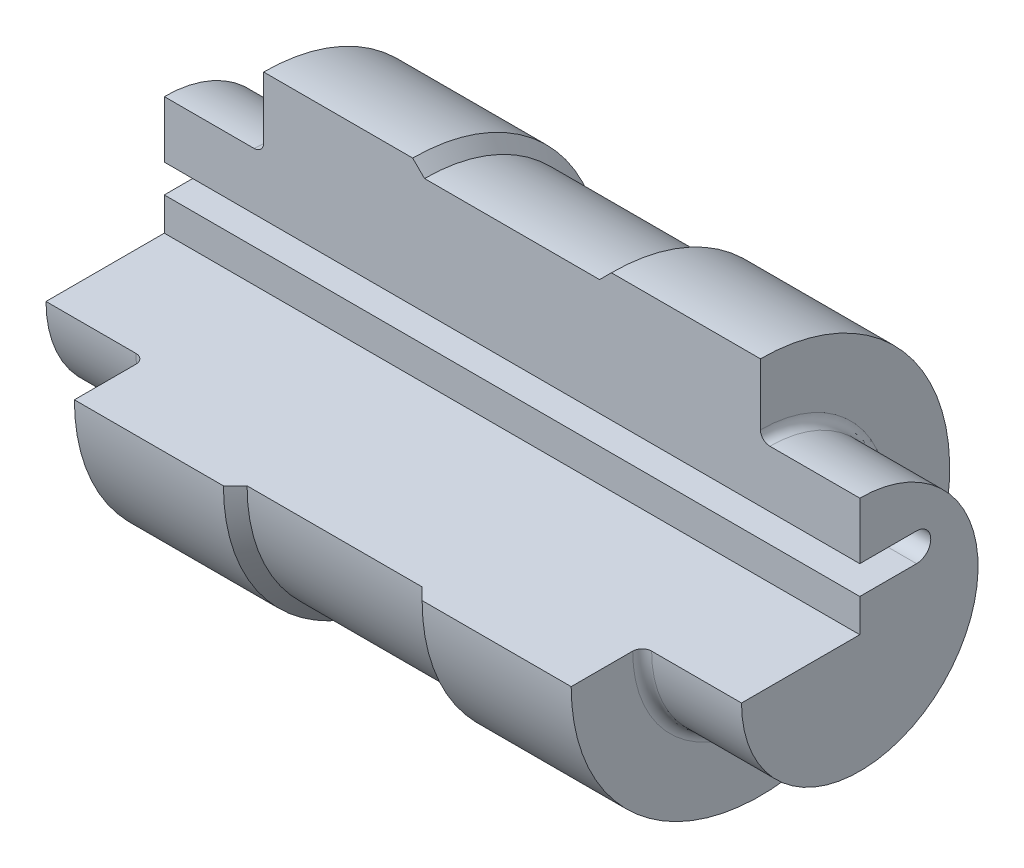
from build123d import *

# Parameters (mm, degrees)
R_VOLUTION1_ANGLE            = 270
ENL_V_MAT_EXTRU_1_DEPTH      = 158.508729917
ENL_V_MAT_EXTRU_1_DEPTH_BACK = 158.508729917
CONG_1_R                     = 2


with BuildPart() as part:
    # Esquisse1 → Révolution1 (revolve)
    with BuildSketch(Plane.XY):
        Polygon((0, 0), (-117.728055077, 0), (-117.728055077, 25), (-96.728055077, 25), (-96.728055077, 40), (-65.228055077, 40), (-62.728055077, 37.5), (-25.728055077, 37.5), (-23.228055077, 40), (8.271944923, 40), (8.271944923, 25), (29.271944923, 25), (29.271944923, 0), align=None)
    revolve(axis=Axis((0, 0, 0), (-1, 0, 0)), revolution_arc=R_VOLUTION1_ANGLE)

    # Esquisse3 → Enlèv. mat.-Extru.1 (cut, two sides: drawn at the far end of the back side and taken through both)
    with BuildSketch(Plane.ZY.offset(117.728055077).offset(-ENL_V_MAT_EXTRU_1_DEPTH_BACK)):
        with BuildLine():
            Line((-12, 13), (0, 13))
            ThreePointArc((0, 13), (3, 10), (0, 7))
            Line((0, 7), (-12, 7))
            ThreePointArc((-12, 7), (-15, 10), (-12, 13))
        make_face()
    extrude(amount=ENL_V_MAT_EXTRU_1_DEPTH + ENL_V_MAT_EXTRU_1_DEPTH_BACK, mode=Mode.SUBTRACT)

    # Congé1
    cong_1_edges = [part.edges().sort_by_distance(p)[0] for p in [
        (8.271944923, -17.67766953, -17.67766953),
        (-96.728055077, -17.67766953, -17.67766953),
    ]]
    fillet(cong_1_edges, radius=CONG_1_R)


solid = part.part
